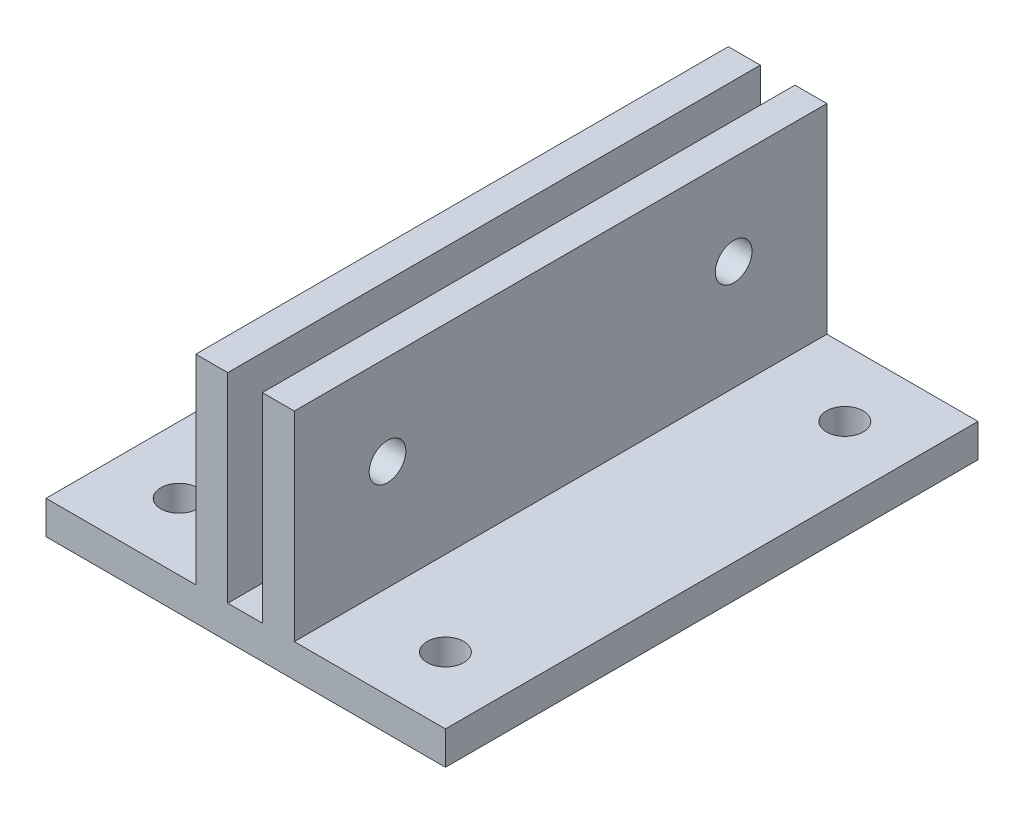
from build123d import *

# Parameters (mm, degrees)
SKETCH1_W           = 38.1
SKETCH1_H           = 50.8
BOSS_EXTRUDE1_DEPTH = 3.175
SKETCH2_W           = 3.048
SKETCH2_H           = 50.8
BOSS_EXTRUDE2_DEPTH = 19.05
SKETCH3_R           = 1.75
CUT_EXTRUDE1_DEPTH  = 38.026544532
SKETCH4_R           = 1.75
CUT_EXTRUDE2_DEPTH  = 42.305517564


with BuildPart() as part:
    # Sketch1 → Boss-Extrude1 (new body)
    with BuildSketch(Plane(origin=(0, 0, 0), x_dir=(1, 0, 0), z_dir=(0, 1, 0))):
        Rectangle(SKETCH1_W, SKETCH1_H)
    extrude(amount=BOSS_EXTRUDE1_DEPTH)

    # Sketch2 → Boss-Extrude2 (add)
    with BuildSketch(Plane(origin=(0, 3.175, 0), x_dir=(1, 0, 0), z_dir=(0, 1, 0))):
        with Locations((-3.2385, 0)):
            Rectangle(SKETCH2_W, SKETCH2_H)
        with Locations((3.1115, 0)):
            Rectangle(SKETCH2_W, SKETCH2_H)
    extrude(amount=BOSS_EXTRUDE2_DEPTH)

    # Sketch3 → Cut-Extrude1 (cut, through all)
    with BuildSketch(Plane(origin=(0, 3.175, 0), x_dir=(1, 0, 0), z_dir=(0, 1, 0))):
        with Locations(Location((-12.7, 19.05, 0), (0, 0, 270))):
            Circle(SKETCH3_R)
        with Locations(Location((-12.7, -19.05, 0), (0, 0, 270))):
            Circle(SKETCH3_R)
        with Locations(Location((12.7, -19.05, 0), (0, 0, 270))):
            Circle(SKETCH3_R)
        with Locations(Location((12.7, 19.05, 0), (0, 0, 270))):
            Circle(SKETCH3_R)
    extrude(amount=-CUT_EXTRUDE1_DEPTH, mode=Mode.SUBTRACT)

    # Sketch4 → Cut-Extrude2 (cut, through all)
    with BuildSketch(Plane.ZY.offset(4.7625)):
        with Locations((-16.51, 13.612832847)):
            Circle(SKETCH4_R)
        with Locations((16.51, 13.612832847)):
            Circle(SKETCH4_R)
    extrude(amount=-CUT_EXTRUDE2_DEPTH, mode=Mode.SUBTRACT)


solid = part.part
